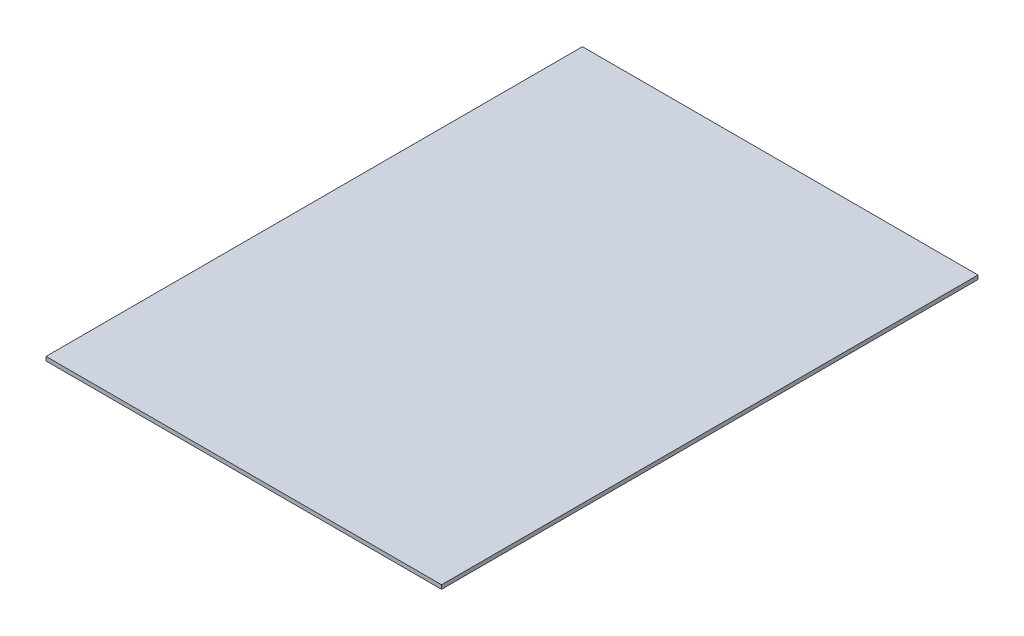
from build123d import *

# Parameters (mm, degrees)
SKETCH1_W           = 300
SKETCH1_H           = 406.9
BOSS_EXTRUDE1_DEPTH = 3


with BuildPart() as part:
    # Sketch1 → Boss-Extrude1 (new body)
    with BuildSketch(Plane(origin=(0, 0, 0), x_dir=(1, 0, 0), z_dir=(0, 1, 0))):
        Rectangle(SKETCH1_W, SKETCH1_H)
    extrude(amount=BOSS_EXTRUDE1_DEPTH)


solid = part.part
